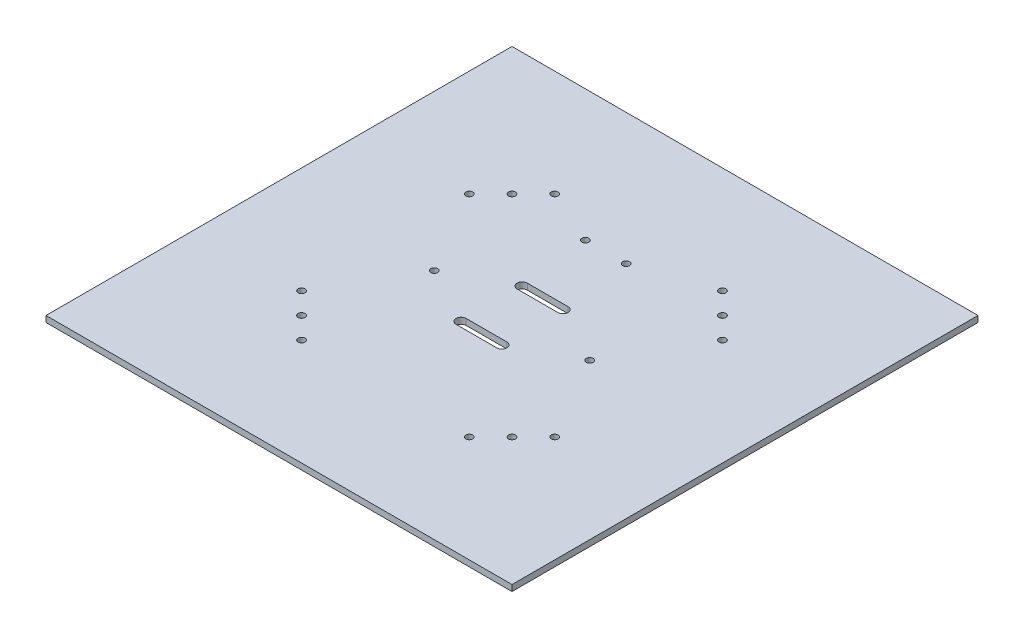
from build123d import *

# Parameters (mm, degrees)
SKETCH1_W                                   = 228.6
SKETCH1_H                                   = 228.6
PLATE_DEPTH                                 = 3
SKETCH8_R                                   = 1.7
MOTOR_MOUNT_HOLES_DEPTH                     = 3
SKETCH9_R                                   = 1.7
CONNECTOR_BOARD_HOLES_DEPTH                 = 3
MOTOR_CONTROLLER_HOLDER_ARDUINO_HOLES_REACH = 163.672
SKETCH11_R                                  = 1.7
CABLE_SLOTS_REACH                           = 163.672


with BuildPart() as part:
    # Sketch1 → plate (new body)
    with BuildSketch(Plane(origin=(0, 0, 0), x_dir=(1, 0, 0), z_dir=(0, 1, 0))):
        Rectangle(SKETCH1_W, SKETCH1_H)
    extrude(amount=PLATE_DEPTH)

    # Sketch8 → motor-mount-holes (cut)
    with BuildSketch(Plane(origin=(0, 3, 0), x_dir=(1, 0, 0), z_dir=(0, 1, 0))):
        with Locations(Location((51.618795027, 51.618795027, 0), (0, 0, 270))):
            Circle(SKETCH8_R)
        with Locations(Location((62.083975388, 41.153614665, 0), (0, 0, 270))):
            Circle(SKETCH8_R)
        with Locations(Location((41.153614665, 62.083975388, 0), (0, 0, 270))):
            Circle(SKETCH8_R)
        with Locations(Location((51.618795027, -51.618795027, 0), (0, 0, 270))):
            Circle(SKETCH8_R)
        with Locations(Location((62.083975388, -41.153614665, 0), (0, 0, 270))):
            Circle(SKETCH8_R)
        with Locations(Location((41.153614665, -62.083975388, 0), (0, 0, 270))):
            Circle(SKETCH8_R)
        with Locations(Location((-51.618795027, -51.618795027, 0), (0, 0, 270))):
            Circle(SKETCH8_R)
        with Locations(Location((-41.153614665, -62.083975388, 0), (0, 0, 270))):
            Circle(SKETCH8_R)
        with Locations(Location((-62.083975388, -41.153614665, 0), (0, 0, 270))):
            Circle(SKETCH8_R)
        with Locations(Location((-51.618795027, 51.618795027, 0), (0, 0, 270))):
            Circle(SKETCH8_R)
        with Locations(Location((-62.083975388, 41.153614665, 0), (0, 0, 270))):
            Circle(SKETCH8_R)
        with Locations(Location((-41.153614665, 62.083975388, 0), (0, 0, 270))):
            Circle(SKETCH8_R)
    extrude(amount=-MOTOR_MOUNT_HOLES_DEPTH, mode=Mode.SUBTRACT)

    # Sketch9 → connector-board-holes (cut)
    with BuildSketch(Plane(origin=(0, 3, 0), x_dir=(1, 0, 0), z_dir=(0, 1, 0))):
        with Locations(Location((-38.13, 0, 0), (0, 0, 270))):
            Circle(SKETCH9_R)
        with Locations(Location((38.13, 0, 0), (0, 0, 270))):
            Circle(SKETCH9_R)
    extrude(amount=-CONNECTOR_BOARD_HOLES_DEPTH, mode=Mode.SUBTRACT)

    # Sketch11 → motor-controller-holder-arduino-holes (cut, up to next)
    with BuildSketch(Plane(origin=(0, 3, 0), x_dir=(1, 0, 0), z_dir=(0, 1, 0)), mode=Mode.PRIVATE) as motor_controller_holder_arduino_holes_sk1:
        with Locations(Location((-14, 50, 0), (0, 0, 270))):
            Circle(SKETCH11_R)
    motor_controller_holder_arduino_holes_tool1 = extrude(motor_controller_holder_arduino_holes_sk1.sketch, amount=-MOTOR_CONTROLLER_HOLDER_ARDUINO_HOLES_REACH, mode=Mode.PRIVATE) & part.part
    # Sketch11 → motor-controller-holder-arduino-holes (cut, up to next)
    with BuildSketch(Plane(origin=(0, 3, 0), x_dir=(1, 0, 0), z_dir=(0, 1, 0)), mode=Mode.PRIVATE) as motor_controller_holder_arduino_holes_sk2:
        with Locations(Location((6, 50, 0), (0, 0, 270))):
            Circle(SKETCH11_R)
    motor_controller_holder_arduino_holes_tool2 = extrude(motor_controller_holder_arduino_holes_sk2.sketch, amount=-MOTOR_CONTROLLER_HOLDER_ARDUINO_HOLES_REACH, mode=Mode.PRIVATE) & part.part
    add(motor_controller_holder_arduino_holes_tool1.solids().sort_by_distance((-14, 3, -50))[0], mode=Mode.SUBTRACT)
    add(motor_controller_holder_arduino_holes_tool2.solids().sort_by_distance((6, 3, -50))[0], mode=Mode.SUBTRACT)

    # Sketch12 → cable-slots (cut, up to next)
    with BuildSketch(Plane(origin=(0, 3, 0), x_dir=(1, 0, 0), z_dir=(0, 1, 0)), mode=Mode.PRIVATE) as cable_slots_sk1:
        with BuildLine():
            Line((-10, 17.5), (10, 17.5))
            ThreePointArc((10, 17.5), (12.5, 15), (10, 12.5))
            Line((10, 12.5), (-10, 12.5))
            ThreePointArc((-10, 12.5), (-12.5, 15), (-10, 17.5))
        make_face()
    cable_slots_tool1 = extrude(cable_slots_sk1.sketch, amount=-CABLE_SLOTS_REACH, mode=Mode.PRIVATE) & part.part
    # Sketch12 → cable-slots (cut, up to next)
    with BuildSketch(Plane(origin=(0, 3, 0), x_dir=(1, 0, 0), z_dir=(0, 1, 0)), mode=Mode.PRIVATE) as cable_slots_sk2:
        with BuildLine():
            Line((-10, -12.5), (10, -12.5))
            ThreePointArc((10, -12.5), (12.5, -15), (10, -17.5))
            Line((10, -17.5), (-10, -17.5))
            ThreePointArc((-10, -17.5), (-12.5, -15), (-10, -12.5))
        make_face()
    cable_slots_tool2 = extrude(cable_slots_sk2.sketch, amount=-CABLE_SLOTS_REACH, mode=Mode.PRIVATE) & part.part
    add(cable_slots_tool1.solids().sort_by_distance((0, 3, -15))[0], mode=Mode.SUBTRACT)
    add(cable_slots_tool2.solids().sort_by_distance((0, 3, 15))[0], mode=Mode.SUBTRACT)


solid = part.part
